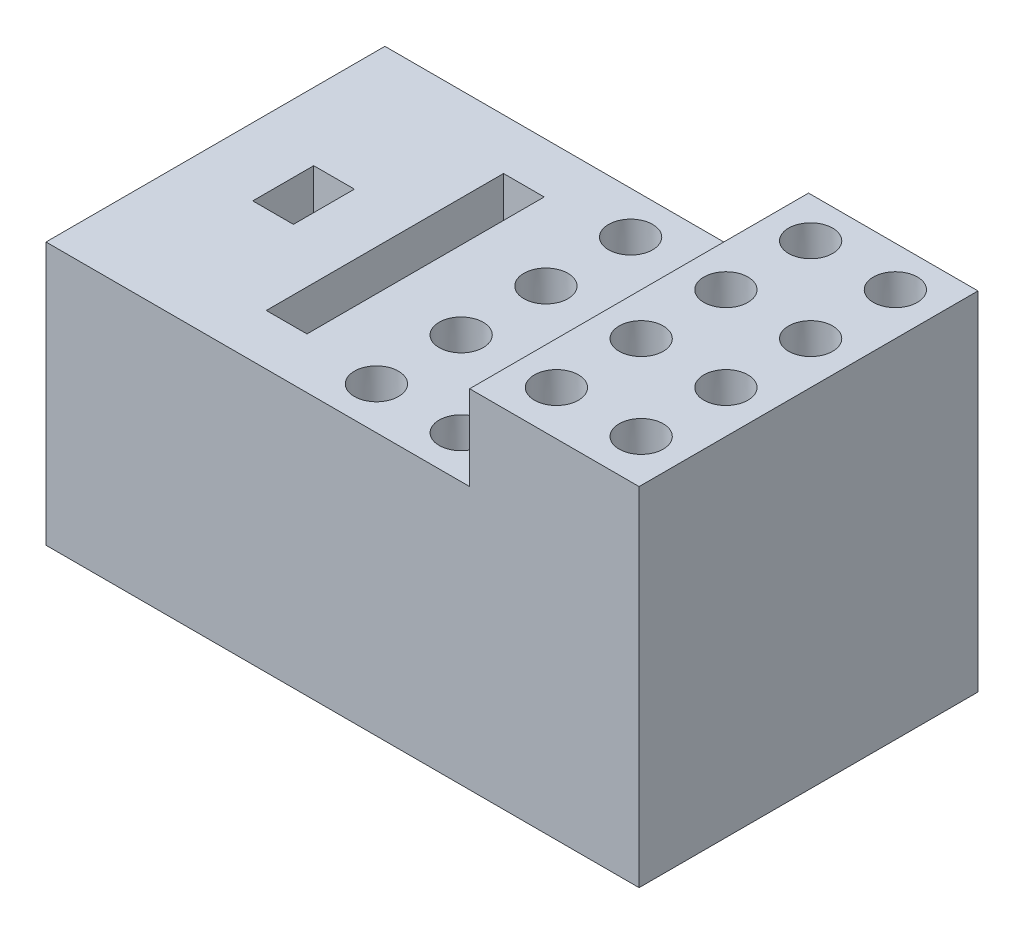
from build123d import *

# Parameters (mm, degrees)
BLOCK_DEPTH                      = 100
SKETCH2_R                        = 6.5
SHARPIE_DEPTH                    = 75
SHARPIE_DRAFT                    = -1.3
SHARPIE_PROFILE_2_DEPTH          = 75
SHARPIE_PROFILE_2_DRAFT          = -1.3
SHARPIE_PROFILE_3_DEPTH          = 75
SHARPIE_PROFILE_3_DRAFT          = -1.3
SHARPIE_PROFILE_4_DEPTH          = 75
SHARPIE_PROFILE_4_DRAFT          = -1.3
SHARPIE_PROFILE_5_DEPTH          = 75
SHARPIE_PROFILE_5_DRAFT          = -1.3
SHARPIE_PROFILE_6_DEPTH          = 75
SHARPIE_PROFILE_6_DRAFT          = -1.3
SHARPIE_PROFILE_7_DEPTH          = 75
SHARPIE_PROFILE_7_DRAFT          = -1.3
SHARPIE_PROFILE_8_DEPTH          = 75
SHARPIE_PROFILE_8_DRAFT          = -1.3
SKETCH3_R                        = 6.5
PREC_SCREWDRIVER_DEPTH           = 100
PREC_SCREWDRIVER_DRAFT           = -1
PREC_SCREWDRIVER_PROFILE_2_DEPTH = 100
PREC_SCREWDRIVER_PROFILE_2_DRAFT = -1
PREC_SCREWDRIVER_PROFILE_3_DEPTH = 100
PREC_SCREWDRIVER_PROFILE_3_DRAFT = -1
PREC_SCREWDRIVER_PROFILE_4_DEPTH = 100
PREC_SCREWDRIVER_PROFILE_4_DRAFT = -1
PREC_SCREWDRIVER_PROFILE_5_DEPTH = 100
PREC_SCREWDRIVER_PROFILE_5_DRAFT = -1
PREC_SCREWDRIVER_PROFILE_6_DEPTH = 100
PREC_SCREWDRIVER_PROFILE_6_DRAFT = -1
PREC_SCREWDRIVER_PROFILE_7_DEPTH = 100
PREC_SCREWDRIVER_PROFILE_7_DRAFT = -1
PREC_SCREWDRIVER_PROFILE_8_DEPTH = 100
PREC_SCREWDRIVER_PROFILE_8_DRAFT = -1
SKETCH4_W                        = 12
SKETCH4_H                        = 70
NEEDLE_NOSE_DEPTH                = 75
NEEDLE_NOSE_DRAFT                = -3
SKETCH6_W                        = 12
SKETCH6_H                        = 18
SCISSOR_DEPTH                    = 75
SCISSOR_DRAFT                    = -3


with BuildPart() as part:
    # Sketch1 → block (new body)
    with BuildSketch(Plane.XY):
        Polygon((0, 0), (175, 0), (175, 102.5), (125, 102.5), (125, 77.5), (0, 77.5), align=None)
    extrude(amount=BLOCK_DEPTH)


with BuildPart() as sharpie_tool:
    # Sketch2 → sharpie (with draft: the straight prism first)
    with BuildSketch(Plane(origin=(0, 77.5, 0), x_dir=(1, 0, 0), z_dir=(0, 1, 0))):
        with Locations((85, -12.5)):
            Circle(SKETCH2_R)
    extrude(amount=-SHARPIE_DEPTH)
    # sharpie: the draft: its side faces are tilted about the plane it starts from
    sharpie_sides = [sharpie_tool.faces().sort_by_distance(p)[0] for p in [
        (78.5, 40, 12.5),
    ]]
    draft(sharpie_sides, Plane(origin=(0, 77.5, 0), x_dir=(1, 0, 0), z_dir=(0, 1, 0)), SHARPIE_DRAFT)


with BuildPart() as part_1:
    add(part.part)

    # sharpie: cut by sharpie_tool
    add(sharpie_tool.part, mode=Mode.SUBTRACT)


with BuildPart() as sharpie_profile_2_tool:
    # Sketch2 → sharpie profile 2 (with draft: the straight prism first)
    with BuildSketch(Plane(origin=(0, 77.5, 0), x_dir=(1, 0, 0), z_dir=(0, 1, 0))):
        with Locations((110, -12.5)):
            Circle(SKETCH2_R)
    extrude(amount=-SHARPIE_PROFILE_2_DEPTH)
    # sharpie profile 2: the draft: its side faces are tilted about the plane it starts from
    sharpie_profile_2_sides = [sharpie_profile_2_tool.faces().sort_by_distance(p)[0] for p in [
        (103.5, 40, 12.5),
    ]]
    draft(sharpie_profile_2_sides, Plane(origin=(0, 77.5, 0), x_dir=(1, 0, 0), z_dir=(0, 1, 0)), SHARPIE_PROFILE_2_DRAFT)


with BuildPart() as part_2:
    add(part_1.part)

    # sharpie profile 2: cut by sharpie_profile_2_tool
    add(sharpie_profile_2_tool.part, mode=Mode.SUBTRACT)


with BuildPart() as sharpie_profile_3_tool:
    # Sketch2 → sharpie profile 3 (with draft: the straight prism first)
    with BuildSketch(Plane(origin=(0, 77.5, 0), x_dir=(1, 0, 0), z_dir=(0, 1, 0))):
        with Locations((110, -37.5)):
            Circle(SKETCH2_R)
    extrude(amount=-SHARPIE_PROFILE_3_DEPTH)
    # sharpie profile 3: the draft: its side faces are tilted about the plane it starts from
    sharpie_profile_3_sides = [sharpie_profile_3_tool.faces().sort_by_distance(p)[0] for p in [
        (103.5, 40, 37.5),
    ]]
    draft(sharpie_profile_3_sides, Plane(origin=(0, 77.5, 0), x_dir=(1, 0, 0), z_dir=(0, 1, 0)), SHARPIE_PROFILE_3_DRAFT)


with BuildPart() as part_3:
    add(part_2.part)

    # sharpie profile 3: cut by sharpie_profile_3_tool
    add(sharpie_profile_3_tool.part, mode=Mode.SUBTRACT)


with BuildPart() as sharpie_profile_4_tool:
    # Sketch2 → sharpie profile 4 (with draft: the straight prism first)
    with BuildSketch(Plane(origin=(0, 77.5, 0), x_dir=(1, 0, 0), z_dir=(0, 1, 0))):
        with Locations((110, -62.5)):
            Circle(SKETCH2_R)
    extrude(amount=-SHARPIE_PROFILE_4_DEPTH)
    # sharpie profile 4: the draft: its side faces are tilted about the plane it starts from
    sharpie_profile_4_sides = [sharpie_profile_4_tool.faces().sort_by_distance(p)[0] for p in [
        (103.5, 40, 62.5),
    ]]
    draft(sharpie_profile_4_sides, Plane(origin=(0, 77.5, 0), x_dir=(1, 0, 0), z_dir=(0, 1, 0)), SHARPIE_PROFILE_4_DRAFT)


with BuildPart() as part_4:
    add(part_3.part)

    # sharpie profile 4: cut by sharpie_profile_4_tool
    add(sharpie_profile_4_tool.part, mode=Mode.SUBTRACT)


with BuildPart() as sharpie_profile_5_tool:
    # Sketch2 → sharpie profile 5 (with draft: the straight prism first)
    with BuildSketch(Plane(origin=(0, 77.5, 0), x_dir=(1, 0, 0), z_dir=(0, 1, 0))):
        with Locations((110, -87.5)):
            Circle(SKETCH2_R)
    extrude(amount=-SHARPIE_PROFILE_5_DEPTH)
    # sharpie profile 5: the draft: its side faces are tilted about the plane it starts from
    sharpie_profile_5_sides = [sharpie_profile_5_tool.faces().sort_by_distance(p)[0] for p in [
        (103.5, 40, 87.5),
    ]]
    draft(sharpie_profile_5_sides, Plane(origin=(0, 77.5, 0), x_dir=(1, 0, 0), z_dir=(0, 1, 0)), SHARPIE_PROFILE_5_DRAFT)


with BuildPart() as part_5:
    add(part_4.part)

    # sharpie profile 5: cut by sharpie_profile_5_tool
    add(sharpie_profile_5_tool.part, mode=Mode.SUBTRACT)


with BuildPart() as sharpie_profile_6_tool:
    # Sketch2 → sharpie profile 6 (with draft: the straight prism first)
    with BuildSketch(Plane(origin=(0, 77.5, 0), x_dir=(1, 0, 0), z_dir=(0, 1, 0))):
        with Locations((85, -37.5)):
            Circle(SKETCH2_R)
    extrude(amount=-SHARPIE_PROFILE_6_DEPTH)
    # sharpie profile 6: the draft: its side faces are tilted about the plane it starts from
    sharpie_profile_6_sides = [sharpie_profile_6_tool.faces().sort_by_distance(p)[0] for p in [
        (78.5, 40, 37.5),
    ]]
    draft(sharpie_profile_6_sides, Plane(origin=(0, 77.5, 0), x_dir=(1, 0, 0), z_dir=(0, 1, 0)), SHARPIE_PROFILE_6_DRAFT)


with BuildPart() as part_6:
    add(part_5.part)

    # sharpie profile 6: cut by sharpie_profile_6_tool
    add(sharpie_profile_6_tool.part, mode=Mode.SUBTRACT)


with BuildPart() as sharpie_profile_7_tool:
    # Sketch2 → sharpie profile 7 (with draft: the straight prism first)
    with BuildSketch(Plane(origin=(0, 77.5, 0), x_dir=(1, 0, 0), z_dir=(0, 1, 0))):
        with Locations((85, -62.5)):
            Circle(SKETCH2_R)
    extrude(amount=-SHARPIE_PROFILE_7_DEPTH)
    # sharpie profile 7: the draft: its side faces are tilted about the plane it starts from
    sharpie_profile_7_sides = [sharpie_profile_7_tool.faces().sort_by_distance(p)[0] for p in [
        (78.5, 40, 62.5),
    ]]
    draft(sharpie_profile_7_sides, Plane(origin=(0, 77.5, 0), x_dir=(1, 0, 0), z_dir=(0, 1, 0)), SHARPIE_PROFILE_7_DRAFT)


with BuildPart() as part_7:
    add(part_6.part)

    # sharpie profile 7: cut by sharpie_profile_7_tool
    add(sharpie_profile_7_tool.part, mode=Mode.SUBTRACT)


with BuildPart() as sharpie_profile_8_tool:
    # Sketch2 → sharpie profile 8 (with draft: the straight prism first)
    with BuildSketch(Plane(origin=(0, 77.5, 0), x_dir=(1, 0, 0), z_dir=(0, 1, 0))):
        with Locations((85, -87.5)):
            Circle(SKETCH2_R)
    extrude(amount=-SHARPIE_PROFILE_8_DEPTH)
    # sharpie profile 8: the draft: its side faces are tilted about the plane it starts from
    sharpie_profile_8_sides = [sharpie_profile_8_tool.faces().sort_by_distance(p)[0] for p in [
        (78.5, 40, 87.5),
    ]]
    draft(sharpie_profile_8_sides, Plane(origin=(0, 77.5, 0), x_dir=(1, 0, 0), z_dir=(0, 1, 0)), SHARPIE_PROFILE_8_DRAFT)


with BuildPart() as part_8:
    add(part_7.part)

    # sharpie profile 8: cut by sharpie_profile_8_tool
    add(sharpie_profile_8_tool.part, mode=Mode.SUBTRACT)


with BuildPart() as prec_screwdriver_tool:
    # Sketch3 → prec screwdriver (with draft: the straight prism first)
    with BuildSketch(Plane(origin=(0, 102.5, 0), x_dir=(1, 0, 0), z_dir=(0, 1, 0))):
        with Locations((137.5, -11.884481683)):
            Circle(SKETCH3_R)
    extrude(amount=-PREC_SCREWDRIVER_DEPTH)
    # prec screwdriver: the draft: its side faces are tilted about the plane it starts from
    prec_screwdriver_sides = [prec_screwdriver_tool.faces().sort_by_distance(p)[0] for p in [
        (131, 52.5, 11.884481683),
    ]]
    draft(prec_screwdriver_sides, Plane(origin=(0, 102.5, 0), x_dir=(1, 0, 0), z_dir=(0, 1, 0)), PREC_SCREWDRIVER_DRAFT)


with BuildPart() as part_9:
    add(part_8.part)

    # prec screwdriver: cut by prec_screwdriver_tool
    add(prec_screwdriver_tool.part, mode=Mode.SUBTRACT)


with BuildPart() as prec_screwdriver_profile_2_tool:
    # Sketch3 → prec screwdriver profile 2 (with draft: the straight prism first)
    with BuildSketch(Plane(origin=(0, 102.5, 0), x_dir=(1, 0, 0), z_dir=(0, 1, 0))):
        with Locations((162.5, -11.884481683)):
            Circle(SKETCH3_R)
    extrude(amount=-PREC_SCREWDRIVER_PROFILE_2_DEPTH)
    # prec screwdriver profile 2: the draft: its side faces are tilted about the plane it starts from
    prec_screwdriver_profile_2_sides = [prec_screwdriver_profile_2_tool.faces().sort_by_distance(p)[0] for p in [
        (156, 52.5, 11.884481683),
    ]]
    draft(prec_screwdriver_profile_2_sides, Plane(origin=(0, 102.5, 0), x_dir=(1, 0, 0), z_dir=(0, 1, 0)), PREC_SCREWDRIVER_PROFILE_2_DRAFT)


with BuildPart() as part_10:
    add(part_9.part)

    # prec screwdriver profile 2: cut by prec_screwdriver_profile_2_tool
    add(prec_screwdriver_profile_2_tool.part, mode=Mode.SUBTRACT)


with BuildPart() as prec_screwdriver_profile_3_tool:
    # Sketch3 → prec screwdriver profile 3 (with draft: the straight prism first)
    with BuildSketch(Plane(origin=(0, 102.5, 0), x_dir=(1, 0, 0), z_dir=(0, 1, 0))):
        with Locations((162.5, -36.884481683)):
            Circle(SKETCH3_R)
    extrude(amount=-PREC_SCREWDRIVER_PROFILE_3_DEPTH)
    # prec screwdriver profile 3: the draft: its side faces are tilted about the plane it starts from
    prec_screwdriver_profile_3_sides = [prec_screwdriver_profile_3_tool.faces().sort_by_distance(p)[0] for p in [
        (156, 52.5, 36.884481683),
    ]]
    draft(prec_screwdriver_profile_3_sides, Plane(origin=(0, 102.5, 0), x_dir=(1, 0, 0), z_dir=(0, 1, 0)), PREC_SCREWDRIVER_PROFILE_3_DRAFT)


with BuildPart() as part_11:
    add(part_10.part)

    # prec screwdriver profile 3: cut by prec_screwdriver_profile_3_tool
    add(prec_screwdriver_profile_3_tool.part, mode=Mode.SUBTRACT)


with BuildPart() as prec_screwdriver_profile_4_tool:
    # Sketch3 → prec screwdriver profile 4 (with draft: the straight prism first)
    with BuildSketch(Plane(origin=(0, 102.5, 0), x_dir=(1, 0, 0), z_dir=(0, 1, 0))):
        with Locations((162.5, -61.884481683)):
            Circle(SKETCH3_R)
    extrude(amount=-PREC_SCREWDRIVER_PROFILE_4_DEPTH)
    # prec screwdriver profile 4: the draft: its side faces are tilted about the plane it starts from
    prec_screwdriver_profile_4_sides = [prec_screwdriver_profile_4_tool.faces().sort_by_distance(p)[0] for p in [
        (156, 52.5, 61.884481683),
    ]]
    draft(prec_screwdriver_profile_4_sides, Plane(origin=(0, 102.5, 0), x_dir=(1, 0, 0), z_dir=(0, 1, 0)), PREC_SCREWDRIVER_PROFILE_4_DRAFT)


with BuildPart() as part_12:
    add(part_11.part)

    # prec screwdriver profile 4: cut by prec_screwdriver_profile_4_tool
    add(prec_screwdriver_profile_4_tool.part, mode=Mode.SUBTRACT)


with BuildPart() as prec_screwdriver_profile_5_tool:
    # Sketch3 → prec screwdriver profile 5 (with draft: the straight prism first)
    with BuildSketch(Plane(origin=(0, 102.5, 0), x_dir=(1, 0, 0), z_dir=(0, 1, 0))):
        with Locations((162.5, -86.884481683)):
            Circle(SKETCH3_R)
    extrude(amount=-PREC_SCREWDRIVER_PROFILE_5_DEPTH)
    # prec screwdriver profile 5: the draft: its side faces are tilted about the plane it starts from
    prec_screwdriver_profile_5_sides = [prec_screwdriver_profile_5_tool.faces().sort_by_distance(p)[0] for p in [
        (156, 52.5, 86.884481683),
    ]]
    draft(prec_screwdriver_profile_5_sides, Plane(origin=(0, 102.5, 0), x_dir=(1, 0, 0), z_dir=(0, 1, 0)), PREC_SCREWDRIVER_PROFILE_5_DRAFT)


with BuildPart() as part_13:
    add(part_12.part)

    # prec screwdriver profile 5: cut by prec_screwdriver_profile_5_tool
    add(prec_screwdriver_profile_5_tool.part, mode=Mode.SUBTRACT)


with BuildPart() as prec_screwdriver_profile_6_tool:
    # Sketch3 → prec screwdriver profile 6 (with draft: the straight prism first)
    with BuildSketch(Plane(origin=(0, 102.5, 0), x_dir=(1, 0, 0), z_dir=(0, 1, 0))):
        with Locations((137.5, -36.884481683)):
            Circle(SKETCH3_R)
    extrude(amount=-PREC_SCREWDRIVER_PROFILE_6_DEPTH)
    # prec screwdriver profile 6: the draft: its side faces are tilted about the plane it starts from
    prec_screwdriver_profile_6_sides = [prec_screwdriver_profile_6_tool.faces().sort_by_distance(p)[0] for p in [
        (131, 52.5, 36.884481683),
    ]]
    draft(prec_screwdriver_profile_6_sides, Plane(origin=(0, 102.5, 0), x_dir=(1, 0, 0), z_dir=(0, 1, 0)), PREC_SCREWDRIVER_PROFILE_6_DRAFT)


with BuildPart() as part_14:
    add(part_13.part)

    # prec screwdriver profile 6: cut by prec_screwdriver_profile_6_tool
    add(prec_screwdriver_profile_6_tool.part, mode=Mode.SUBTRACT)


with BuildPart() as prec_screwdriver_profile_7_tool:
    # Sketch3 → prec screwdriver profile 7 (with draft: the straight prism first)
    with BuildSketch(Plane(origin=(0, 102.5, 0), x_dir=(1, 0, 0), z_dir=(0, 1, 0))):
        with Locations((137.5, -61.884481683)):
            Circle(SKETCH3_R)
    extrude(amount=-PREC_SCREWDRIVER_PROFILE_7_DEPTH)
    # prec screwdriver profile 7: the draft: its side faces are tilted about the plane it starts from
    prec_screwdriver_profile_7_sides = [prec_screwdriver_profile_7_tool.faces().sort_by_distance(p)[0] for p in [
        (131, 52.5, 61.884481683),
    ]]
    draft(prec_screwdriver_profile_7_sides, Plane(origin=(0, 102.5, 0), x_dir=(1, 0, 0), z_dir=(0, 1, 0)), PREC_SCREWDRIVER_PROFILE_7_DRAFT)


with BuildPart() as part_15:
    add(part_14.part)

    # prec screwdriver profile 7: cut by prec_screwdriver_profile_7_tool
    add(prec_screwdriver_profile_7_tool.part, mode=Mode.SUBTRACT)


with BuildPart() as prec_screwdriver_profile_8_tool:
    # Sketch3 → prec screwdriver profile 8 (with draft: the straight prism first)
    with BuildSketch(Plane(origin=(0, 102.5, 0), x_dir=(1, 0, 0), z_dir=(0, 1, 0))):
        with Locations((137.5, -86.884481683)):
            Circle(SKETCH3_R)
    extrude(amount=-PREC_SCREWDRIVER_PROFILE_8_DEPTH)
    # prec screwdriver profile 8: the draft: its side faces are tilted about the plane it starts from
    prec_screwdriver_profile_8_sides = [prec_screwdriver_profile_8_tool.faces().sort_by_distance(p)[0] for p in [
        (131, 52.5, 86.884481683),
    ]]
    draft(prec_screwdriver_profile_8_sides, Plane(origin=(0, 102.5, 0), x_dir=(1, 0, 0), z_dir=(0, 1, 0)), PREC_SCREWDRIVER_PROFILE_8_DRAFT)


with BuildPart() as part_16:
    add(part_15.part)

    # prec screwdriver profile 8: cut by prec_screwdriver_profile_8_tool
    add(prec_screwdriver_profile_8_tool.part, mode=Mode.SUBTRACT)


with BuildPart() as needle_nose_tool:
    # Sketch4 → needle nose (with draft: the straight prism first)
    with BuildSketch(Plane(origin=(0, 77.5, 0), x_dir=(1, 0, 0), z_dir=(0, 1, 0))):
        with Locations((56, -50)):
            Rectangle(SKETCH4_W, SKETCH4_H)
    extrude(amount=-NEEDLE_NOSE_DEPTH)
    # needle nose: the draft: its side faces are tilted about the plane it starts from
    needle_nose_sides = [needle_nose_tool.faces().sort_by_distance(p)[0] for p in [
        (62, 40, 50),
        (56, 40, 15),
        (50, 40, 50),
        (56, 40, 85),
    ]]
    draft(needle_nose_sides, Plane(origin=(0, 77.5, 0), x_dir=(1, 0, 0), z_dir=(0, 1, 0)), NEEDLE_NOSE_DRAFT)


with BuildPart() as part_17:
    add(part_16.part)

    # needle nose: cut by needle_nose_tool
    add(needle_nose_tool.part, mode=Mode.SUBTRACT)


with BuildPart() as scissor_tool:
    # Sketch6 → scissor (with draft: the straight prism first)
    with BuildSketch(Plane(origin=(0, 77.5, 0), x_dir=(1, 0, 0), z_dir=(0, 1, 0))):
        with Locations((26, -50)):
            Rectangle(SKETCH6_W, SKETCH6_H)
    extrude(amount=-SCISSOR_DEPTH)
    # scissor: the draft: its side faces are tilted about the plane it starts from
    scissor_sides = [scissor_tool.faces().sort_by_distance(p)[0] for p in [
        (32, 40, 50),
        (26, 40, 41),
        (20, 40, 50),
        (26, 40, 59),
    ]]
    draft(scissor_sides, Plane(origin=(0, 77.5, 0), x_dir=(1, 0, 0), z_dir=(0, 1, 0)), SCISSOR_DRAFT)


with BuildPart() as part_18:
    add(part_17.part)

    # scissor: cut by scissor_tool
    add(scissor_tool.part, mode=Mode.SUBTRACT)


solid = part_18.part
